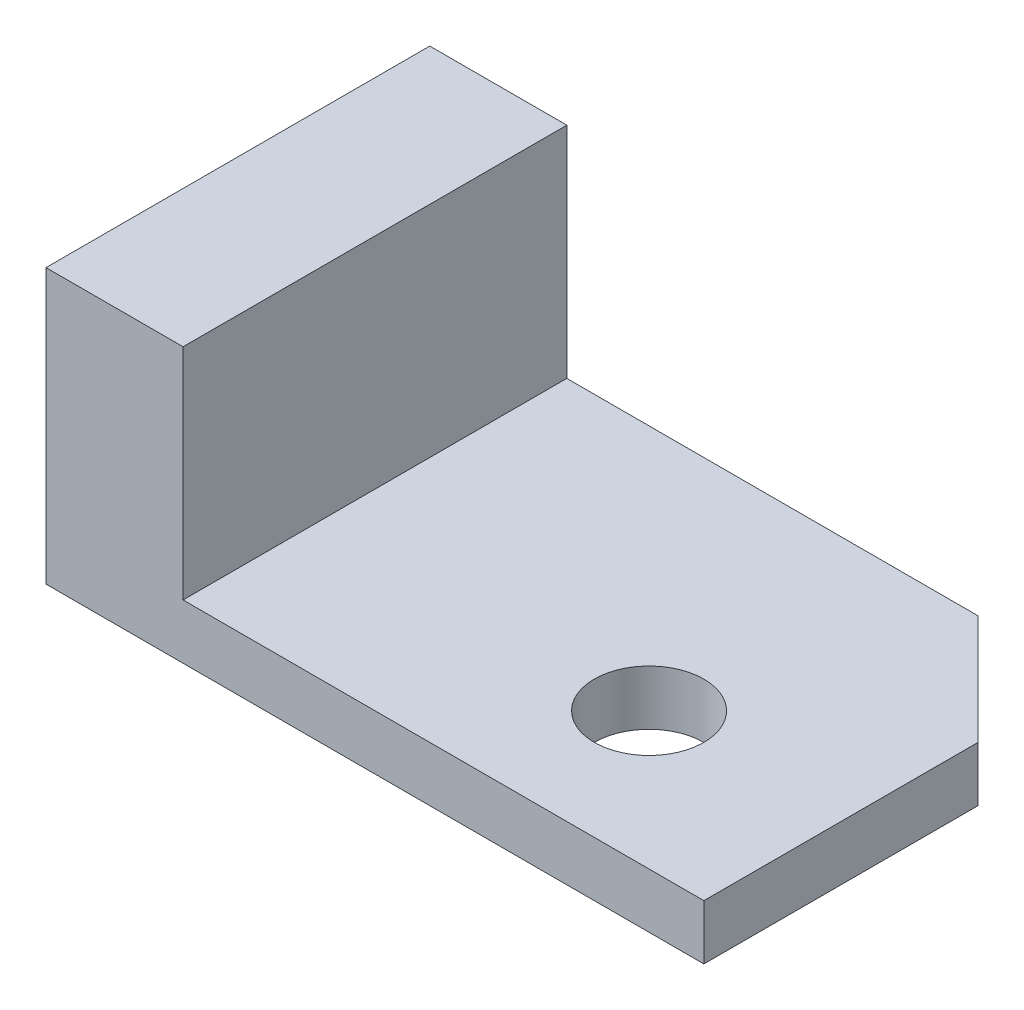
from build123d import *

# Parameters (mm, degrees)
SKETCH1_W           = 120
SKETCH1_H           = 70
BOSS_EXTRUDE1_DEPTH = 10
SKETCH2_W           = 25
SKETCH2_H           = 70
BOSS_EXTRUDE2_DEPTH = 40
SKETCH3_R           = 10
CUT_EXTRUDE1_DEPTH  = 148.648230602
CHAMFER1_SIZE       = 20


with BuildPart() as part:
    # Sketch1 → Boss-Extrude1 (new body)
    with BuildSketch(Plane(origin=(0, 0, 0), x_dir=(1, 0, 0), z_dir=(0, 1, 0))):
        with Locations((60, 35)):
            Rectangle(SKETCH1_W, SKETCH1_H)
    extrude(amount=BOSS_EXTRUDE1_DEPTH)

    # Sketch2 → Boss-Extrude2 (add)
    with BuildSketch(Plane(origin=(0, 10, 0), x_dir=(1, 0, 0), z_dir=(0, 1, 0))):
        with Locations((12.5, 35)):
            Rectangle(SKETCH2_W, SKETCH2_H)
    extrude(amount=BOSS_EXTRUDE2_DEPTH)

    # Sketch3 → Cut-Extrude1 (cut, through all)
    with BuildSketch(Plane(origin=(0, 0, 0), x_dir=(1, 0, 0), z_dir=(0, 1, 0))):
        with Locations(Location((85, 25, 0), (0, 0, 90))):
            Circle(SKETCH3_R)
    extrude(amount=CUT_EXTRUDE1_DEPTH, mode=Mode.SUBTRACT)

    # Chamfer1
    chamfer1_edges = [part.edges().sort_by_distance(p)[0] for p in [
        (120, 5, -70),
    ]]
    chamfer(chamfer1_edges, length=CHAMFER1_SIZE)


solid = part.part
